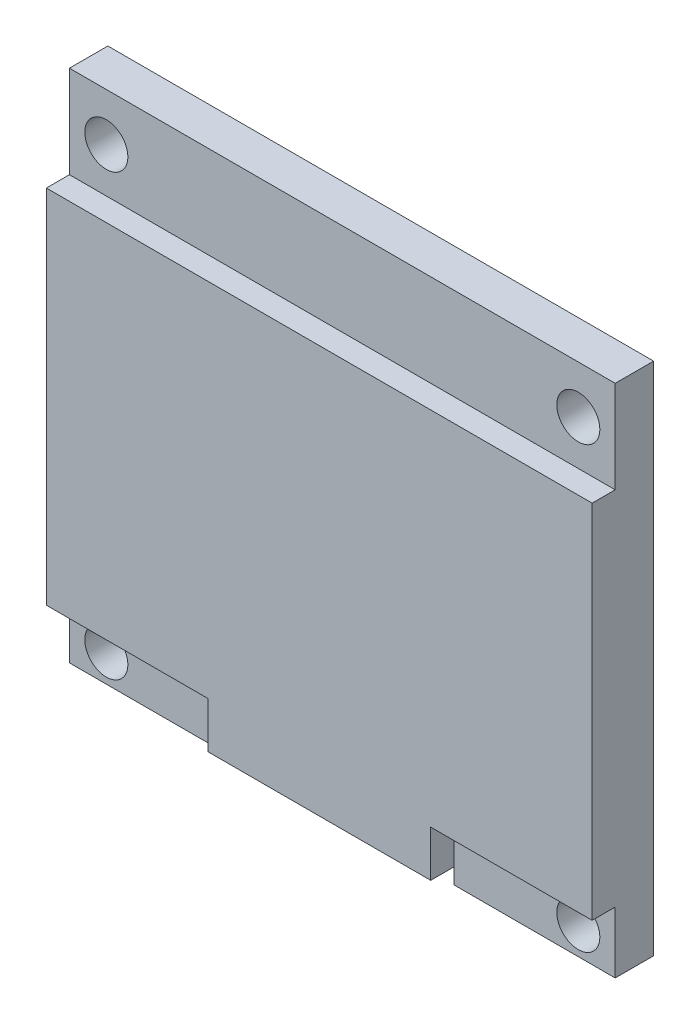
from build123d import *

# Parameters (mm, degrees)
SKETCH_1_W             = 35.5
SKETCH_1_H             = 33.5
EXTRUDE_227_DEPTH      = 2.5
SKETCH_3_W             = 14.5
SKETCH_3_H             = 3
EXTRUDE_815_DEPTH      = 1.5
SKETCH_4_W             = 14.5
SKETCH_4_H             = 1
CUT_EXTRUDE_1043_DEPTH = 25.533140851
SKETCH_5_R             = 1.4
CUT_EXTRUDE_2_DEPTH    = 25.533140851
SKETCH_6_R             = 1.4
CUT_EXTRUDE_3_DEPTH    = 25.533140851


with BuildPart() as part:
    # 草图1 → Extrude 227 (new body)
    with BuildSketch(Plane.XY):
        Rectangle(SKETCH_1_W, SKETCH_1_H)
    extrude(amount=EXTRUDE_227_DEPTH)

    # 草图3 → Extrude 815 (add)
    with BuildSketch(Plane.XY.offset(2.5)):
        Polygon((-17.75, 10.75), (-17.75, -12.75), (-7.25, -12.75), (7.25, -12.75), (17.75, -12.75), (17.75, 10.75), align=None)
        with Locations((0, -14.25)):
            Rectangle(SKETCH_3_W, SKETCH_3_H)
    extrude(amount=EXTRUDE_815_DEPTH)

    # 草图4 → Cut-Extrude 1043 (cut, through all)
    with BuildSketch(Plane.XY.offset(2.5)):
        with Locations((0, -16.25)):
            Rectangle(SKETCH_4_W, SKETCH_4_H)
    extrude(amount=-CUT_EXTRUDE_1043_DEPTH, mode=Mode.SUBTRACT)

    # 草图5 → 切除-拉伸2 (cut, through all)
    with BuildSketch(Plane.XY.offset(2.5)):
        with Locations((15.35, 13.65)):
            Circle(SKETCH_5_R)
        with Locations(Location((-15.35, 13.65, 0), (0, 0, 180))):
            Circle(SKETCH_5_R)
    extrude(amount=-CUT_EXTRUDE_2_DEPTH, mode=Mode.SUBTRACT)

    # 草图6 → 切除-拉伸3 (cut, through all)
    with BuildSketch(Plane.XY.offset(2.5)):
        with Locations((15.35, -14.95)):
            Circle(SKETCH_6_R)
    cut_extrude_3 = extrude(amount=-CUT_EXTRUDE_3_DEPTH, mode=Mode.SUBTRACT)

    # 镜向1: 切除-拉伸3 across plane
    add(cut_extrude_3.mirror(Plane(origin=(0, 0, 0), x_dir=(0, 0, 1), z_dir=(1, 0, 0))), mode=Mode.SUBTRACT)


solid = part.part
